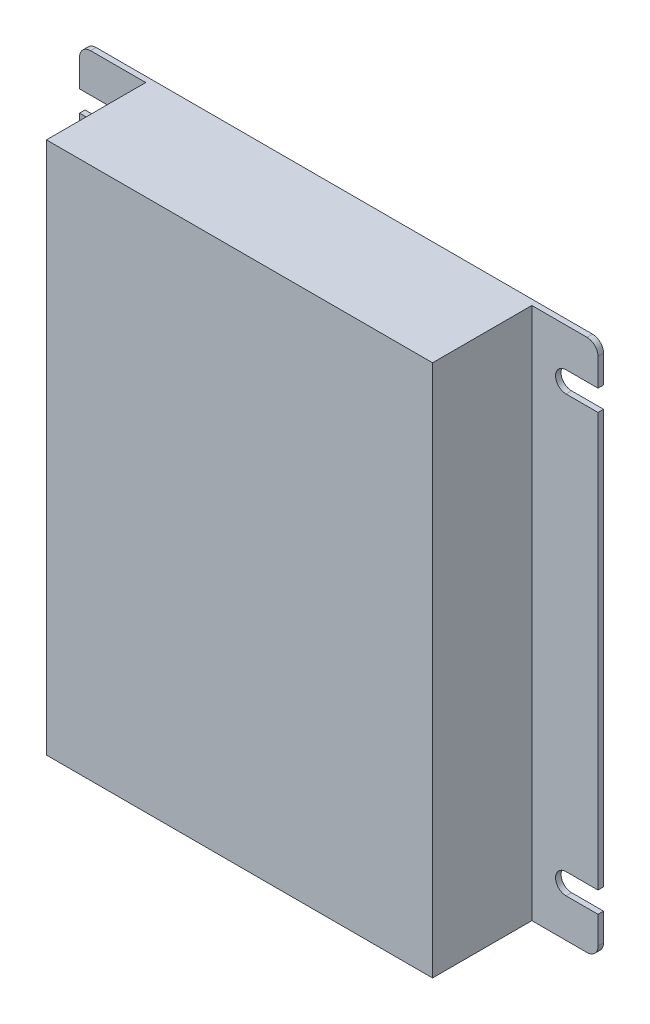
from build123d import *

# Parameters (mm, degrees)
SKETCH1_W           = 119.38
SKETCH1_H           = 122.682
BOSS_EXTRUDE1_DEPTH = 24.13
SKETCH2_W           = 15.24
SKETCH2_H           = 22.86
CUT_EXTRUDE1_DEPTH  = 139.549724374
CUT_EXTRUDE2_DEPTH  = 89.590033192
FILLET1_R           = 2.54


with BuildPart() as part:
    # Sketch1 → Boss-Extrude1 (new body)
    with BuildSketch(Plane.XY):
        Rectangle(SKETCH1_W, SKETCH1_H)
    extrude(amount=BOSS_EXTRUDE1_DEPTH)

    # Sketch2 → Cut-Extrude1 (cut, through all)
    with BuildSketch(Plane.XZ.offset(61.341)):
        with Locations((52.07, 12.7)):
            Rectangle(SKETCH2_W, SKETCH2_H)
        with Locations((-52.07, 12.7)):
            Rectangle(SKETCH2_W, SKETCH2_H)
    extrude(amount=-CUT_EXTRUDE1_DEPTH, mode=Mode.SUBTRACT)

    # Sketch3 → Cut-Extrude2 (cut, through all)
    with BuildSketch(Plane.XY.offset(1.27)):
        with BuildLine():
            Line((-59.69, 52.451), (-52.324, 52.451))
            ThreePointArc((-52.324, 52.451), (-49.911, 50.038), (-52.324, 47.625))
            Line((-52.324, 47.625), (-59.69, 47.625))
            ThreePointArc((-59.69, 47.625), (-62.103, 50.038), (-59.69, 52.451))
        make_face()
        with BuildLine():
            Line((-59.69, -47.625), (-52.324, -47.625))
            ThreePointArc((-52.324, -47.625), (-49.911, -50.038), (-52.324, -52.451))
            Line((-52.324, -52.451), (-59.69, -52.451))
            ThreePointArc((-59.69, -52.451), (-62.103, -50.038), (-59.69, -47.625))
        make_face()
        with BuildLine():
            Line((59.69, -52.451), (52.324, -52.451))
            ThreePointArc((52.324, -52.451), (49.911, -50.038), (52.324, -47.625))
            Line((52.324, -47.625), (59.69, -47.625))
            ThreePointArc((59.69, -47.625), (62.103, -50.038), (59.69, -52.451))
        make_face()
        with BuildLine():
            Line((59.69, 47.625), (52.324, 47.625))
            ThreePointArc((52.324, 47.625), (49.911, 50.038), (52.324, 52.451))
            Line((52.324, 52.451), (59.69, 52.451))
            ThreePointArc((59.69, 52.451), (62.103, 50.038), (59.69, 47.625))
        make_face()
    extrude(amount=-CUT_EXTRUDE2_DEPTH, mode=Mode.SUBTRACT)

    # Fillet1
    fillet1_edges = [part.edges().sort_by_distance(p)[0] for p in [
        (59.69, -61.341, 0.635),
        (-59.69, -61.341, 0.635),
        (-59.69, 61.341, 0.635),
        (59.69, 61.341, 0.635),
    ]]
    fillet(fillet1_edges, radius=FILLET1_R)


solid = part.part
